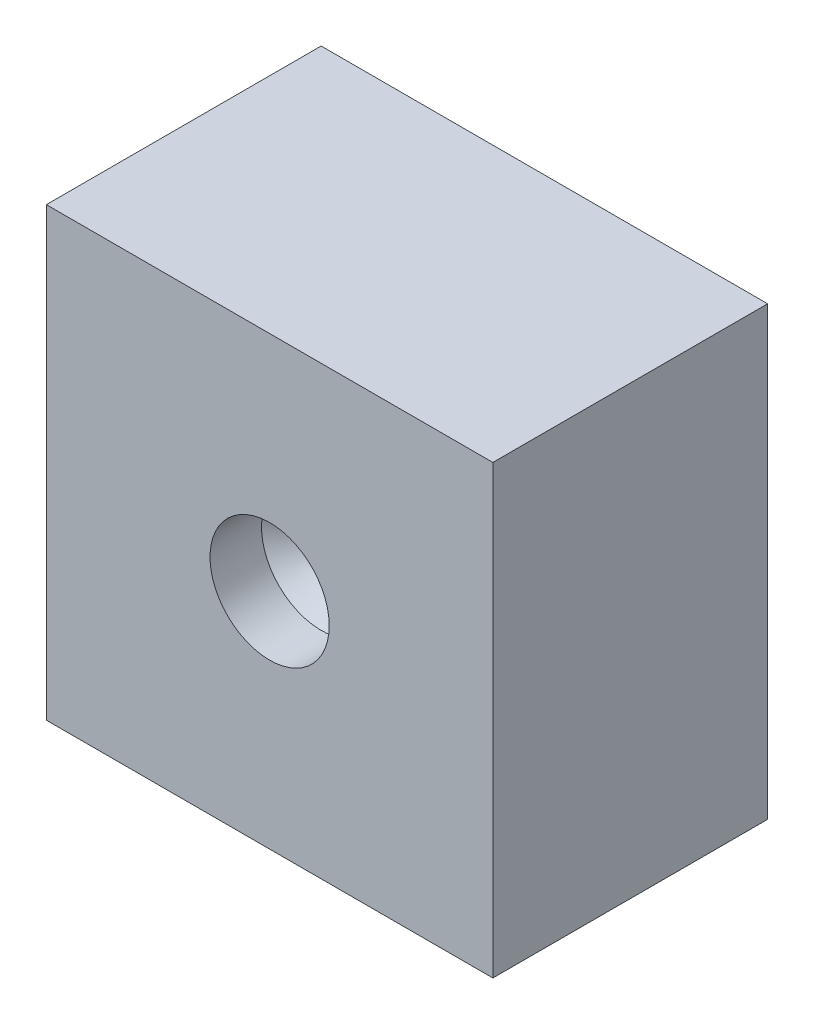
from build123d import *

# Parameters (mm, degrees)
SKIZZE2_W                       = 26
SKIZZE2_H                       = 26
AUFSATZ_LINEAR_AUSTRAGEN1_DEPTH = 16


with BuildPart() as part:
    # Skizze2 → Aufsatz-Linear austragen1 (new body)
    with BuildSketch(Plane(origin=(0, 0, 0), x_dir=(0, 1, 0), z_dir=(0, 0, 1))):
        Rectangle(SKIZZE2_W, SKIZZE2_H)
    extrude(amount=AUFSATZ_LINEAR_AUSTRAGEN1_DEPTH)

    # Skizze5 → Formsenkung für M3 Senkschraube mit Innensechskant1 (revolve, cut)
    with BuildSketch(Plane(origin=(0, 0, 16), x_dir=(0, -1, 0), z_dir=(1, 0, 0))):
        Polygon((0, 0), (0, 16), (1.7, 16), (1.7, 4.77), (3.47, 3), (3.47, 0), align=None)
    revolve(axis=Axis((0, 0, 22.35), (0, 0, -1)), mode=Mode.SUBTRACT)


solid = part.part
